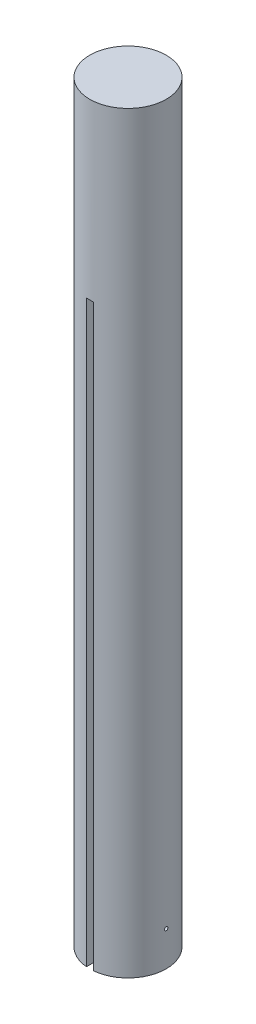
from build123d import *
from build123d.topology import SkipClean

# Parameters (mm, degrees)
SKETCH1_R               = 11
BOSS_EXTRUDE1_DEPTH     = 216.66667
SKETCH6_R               = 7
CUT_EXTRUDE3_DEPTH      = 20
CUT_EXTRUDE4_DEPTH      = 218.224413658
CUT_EXTRUDE4_DEPTH_BACK = 218.224413658
SKETCH7_R               = 0.5
CUT_EXTRUDE5_DEPTH      = 218.224413767
CUT_EXTRUDE5_DEPTH_BACK = 218.224413767
SKETCH10_R              = 0.5
CUT_EXTRUDE6_DEPTH      = 218.224413767
CUT_EXTRUDE6_DEPTH_BACK = 218.224413767
SKETCH11_W              = 2
SKETCH11_H              = 216.66667
BOSS_EXTRUDE4_START     = 216.66667
SKETCH16_R              = 11
BOSS_EXTRUDE4_DEPTH     = 50


with BuildPart() as part:
    # Sketch1 → Boss-Extrude1 (new body)
    with BuildSketch(Plane(origin=(0, 0, 0), x_dir=(1, 0, 0), z_dir=(0, 1, 0))):
        with Locations(Location((0, 0, 0), (0, 0, 270))):
            Circle(SKETCH1_R)
    extrude(amount=BOSS_EXTRUDE1_DEPTH)

    # Sketch6 → Cut-Extrude3 (cut)
    with BuildSketch(Plane(origin=(0, 0, 0), x_dir=(1, 0, 0), z_dir=(0, 1, 0))):
        with Locations(Location((0, 0, 0), (0, 0, 270))):
            Circle(SKETCH6_R)
    extrude(amount=CUT_EXTRUDE3_DEPTH, mode=Mode.SUBTRACT)

    # Sketch7 → Cut-Extrude4 (cut, two sides: drawn at the far end of the back side and taken through both)
    with BuildSketch(Plane(origin=(0, 0, 0), x_dir=(0, 0, -1), z_dir=(1, 0, 0)).offset(-CUT_EXTRUDE4_DEPTH_BACK)):
        with Locations((0, 10)):
            Circle(SKETCH7_R)
    extrude(amount=CUT_EXTRUDE4_DEPTH + CUT_EXTRUDE4_DEPTH_BACK, mode=Mode.SUBTRACT)

    # Sketch10 → Cut-Extrude5 (cut, two sides: drawn at the far end of the back side and taken through both)
    with BuildSketch(Plane.XY.offset(-CUT_EXTRUDE5_DEPTH_BACK)):
        with Locations((0, 5)):
            Circle(SKETCH10_R)
    extrude(amount=CUT_EXTRUDE5_DEPTH + CUT_EXTRUDE5_DEPTH_BACK, mode=Mode.SUBTRACT)

    # Sketch11 → Cut-Extrude6 (cut, two sides: drawn at the far end of the back side and taken through both)
    with BuildSketch(Plane.XY.offset(-CUT_EXTRUDE6_DEPTH_BACK)):
        with Locations((0, 108.333335)):
            Rectangle(SKETCH11_W, SKETCH11_H)
    extrude(amount=CUT_EXTRUDE6_DEPTH + CUT_EXTRUDE6_DEPTH_BACK, mode=Mode.SUBTRACT)


with BuildPart() as cut_extrude6_piece_1:
    # of the separate pieces the step leaves, piece 1, a body of its own (cut_extrude6_pieces)
    add(part.part.solids().sort_by_distance((-1, 0, -10.95445115))[0])



with BuildPart() as cut_extrude6_piece_2:
    # of the separate pieces the step leaves, piece 2, a body of its own (cut_extrude6_pieces)
    add(part.part.solids().sort_by_distance((1, 0, 10.95445115))[0])


with BuildPart() as cut_extrude6_piece_1_1:
    with SkipClean():  # the faces are left unmerged after this step: merging them gives an invalid solid
        add(cut_extrude6_piece_1.part)

        add(cut_extrude6_piece_2.part)  # Boss-Extrude4 merges Cut-Extrude6 piece 2
        # Sketch16 → Boss-Extrude4 (add)
        with BuildSketch(Plane(origin=(0, 0, 0), x_dir=(1, 0, 0), z_dir=(0, 1, 0)).offset(BOSS_EXTRUDE4_START)):
            with Locations(Location((0, 0, 0), (0, 0, 84.78409143))):
                Circle(SKETCH16_R)
        extrude(amount=-BOSS_EXTRUDE4_DEPTH)


solid = cut_extrude6_piece_1_1.part
